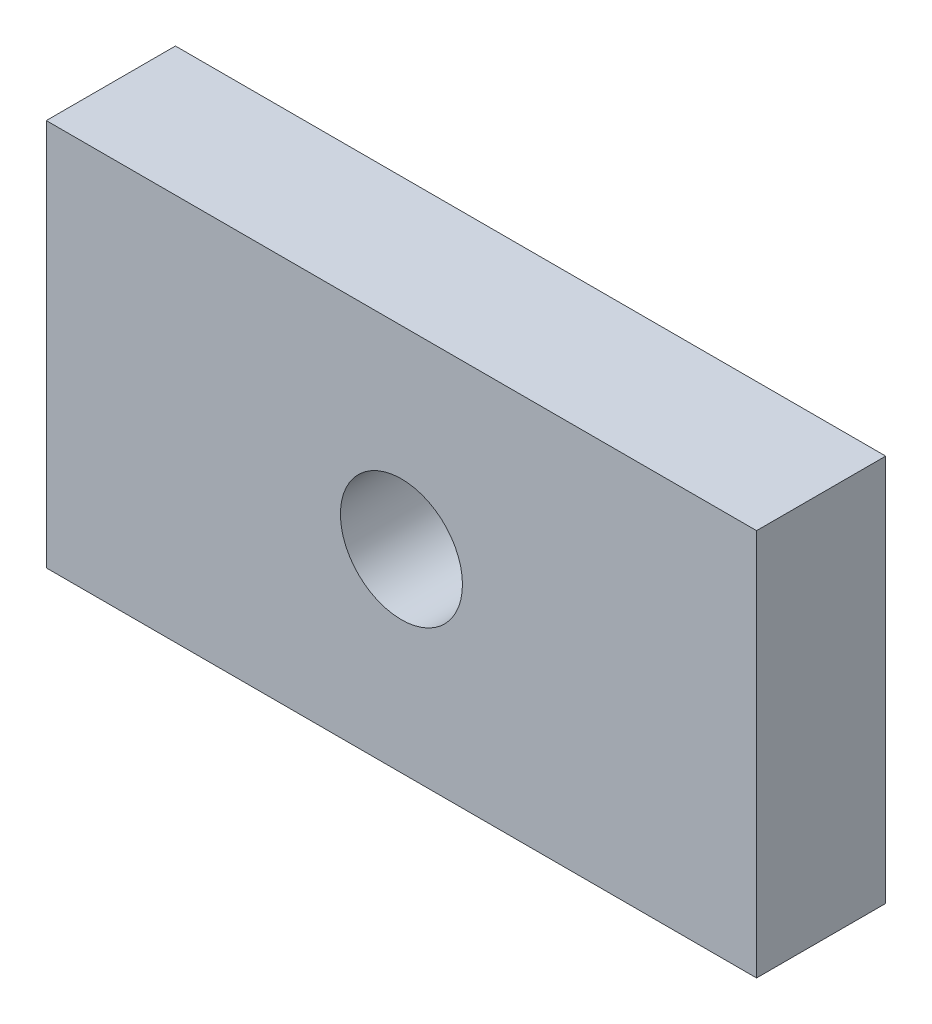
from build123d import *

# Parameters (mm, degrees)
SKIZZE1_W                       = 110
SKIZZE1_H                       = 60
SKIZZE1_R                       = 9.450568715
AUFSATZ_LINEAR_AUSTRAGEN1_DEPTH = 20


with BuildPart() as part:
    # Skizze1 → Aufsatz-Linear austragen1 (new body)
    with BuildSketch(Plane.XY):
        Rectangle(SKIZZE1_W, SKIZZE1_H)
        Circle(SKIZZE1_R, mode=Mode.SUBTRACT)
    extrude(amount=AUFSATZ_LINEAR_AUSTRAGEN1_DEPTH)


solid = part.part
